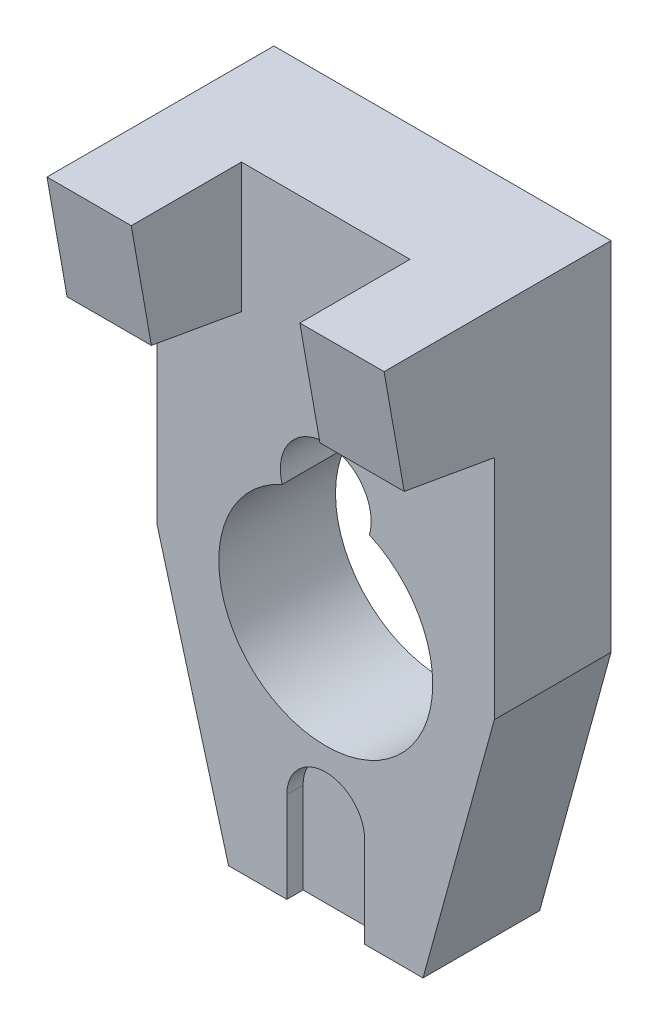
from build123d import *

# Parameters (mm, degrees)
EXTRUDE_1_DEPTH     = 18
EXTRUDE_2_DEPTH     = 13
CUT_EXTRUDE_1_DEPTH = 2.5


with BuildPart() as part:
    # 草图1 → 凸台-拉伸1 (new body)
    with BuildSketch(Plane.XY):
        Polygon((-26, 0), (-15, -40), (15, -40), (26, 0), (26, 55), (-26, 55), align=None)
        with BuildLine():
            ThreePointArc((-6.727579547, 15.066176471), (0, -16.5), (6.727579547, 15.066176471))
            ThreePointArc((6.727579547, 15.066176471), (0, 24), (-6.727579547, 15.066176471))
        make_face(mode=Mode.SUBTRACT)
    extrude(amount=EXTRUDE_1_DEPTH)

    # 草图2 → 凸台-拉伸2 (add)
    with BuildSketch(Plane(origin=(26, 0, 0), x_dir=(0, 0, -1), z_dir=(1, 0, 0))):
        Polygon((-18, 55), (-18, 35), (-31.905808723, 37.451969267), (-35, 55), align=None)
    extrude_2 = extrude(amount=-EXTRUDE_2_DEPTH)

    # 镜向1: 凸台-拉伸2 across plane
    add(extrude_2.mirror(Plane(origin=(0, 0, 0), x_dir=(0, 0, 1), z_dir=(1, 0, 0))))

    # 草图3 → 切除-拉伸1 (cut, symmetric)
    with BuildSketch(Plane.XY.offset(18)):
        with BuildLine():
            Line((-6, -26), (-6, -55.48155058))
            Line((-6, -55.48155058), (6, -55.48155058))
            Line((6, -55.48155058), (6, -26))
            ThreePointArc((6, -26), (0, -20), (-6, -26))
        make_face()
    extrude(amount=CUT_EXTRUDE_1_DEPTH, both=True, mode=Mode.SUBTRACT)


solid = part.part
